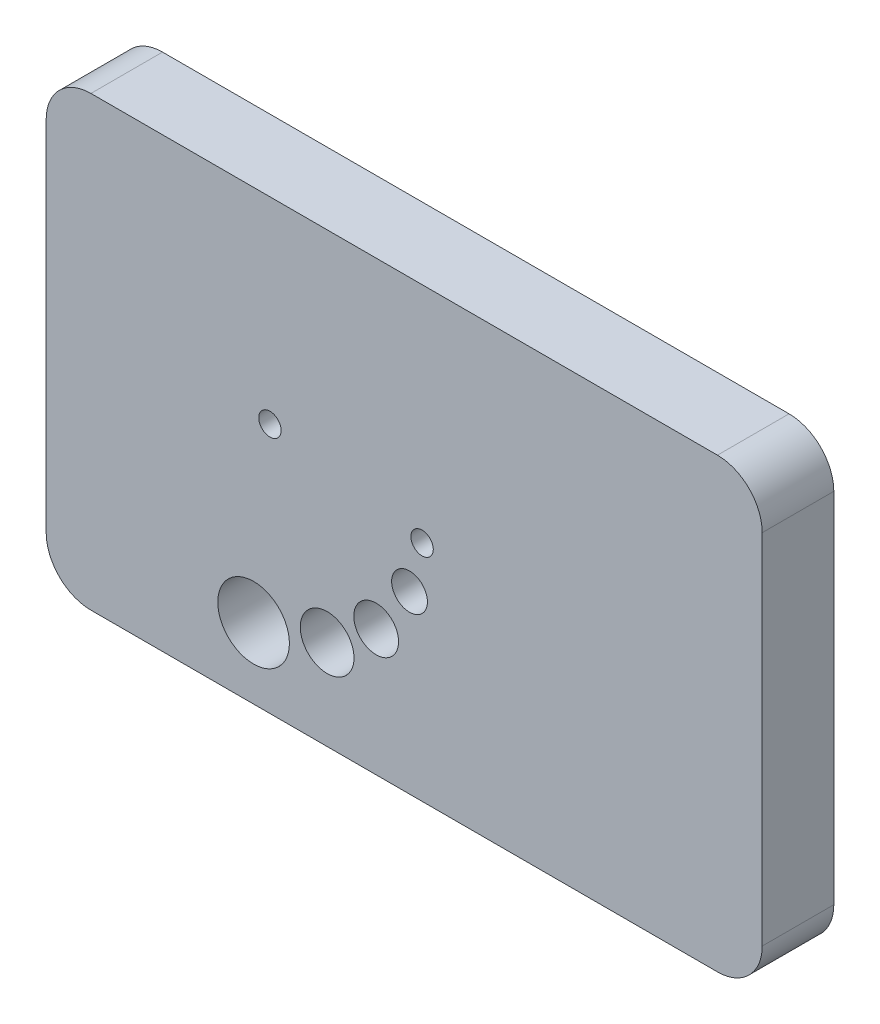
from build123d import *

# Parameters (mm, degrees)
SKETCH1_W           = 80
SKETCH1_H           = 50
SKETCH1_R           = 1.25
SKETCH1_R_2         = 2
SKETCH1_R_3         = 2.5
SKETCH1_R_4         = 3
SKETCH1_R_5         = 4
BOSS_EXTRUDE1_DEPTH = 8
FILLET1_R           = 5


with BuildPart() as part:
    # Sketch1 → Boss-Extrude1 (new body)
    with BuildSketch(Plane.XY):
        with Locations((40, 25)):
            Rectangle(SKETCH1_W, SKETCH1_H)
        with Locations((25, 28)):
            Circle(SKETCH1_R, mode=Mode.SUBTRACT)
        with Locations((42, 25)):
            Circle(SKETCH1_R, mode=Mode.SUBTRACT)
        with Locations((40.595511613, 19.598395279)):
            Circle(SKETCH1_R_2, mode=Mode.SUBTRACT)
        with Locations((36.870108541, 14.119861351)):
            Circle(SKETCH1_R_3, mode=Mode.SUBTRACT)
        with Locations((31.391574613, 10.065746244)):
            Circle(SKETCH1_R_4, mode=Mode.SUBTRACT)
        with Locations((23.173773721, 7.874332673)):
            Circle(SKETCH1_R_5, mode=Mode.SUBTRACT)
    extrude(amount=BOSS_EXTRUDE1_DEPTH)

    # Fillet1
    fillet1_edges = [part.edges().sort_by_distance(p)[0] for p in [
        (0, 50, 4),
        (80, 50, 4),
        (80, 0, 4),
        (0, 0, 4),
    ]]
    fillet(fillet1_edges, radius=FILLET1_R)


solid = part.part
